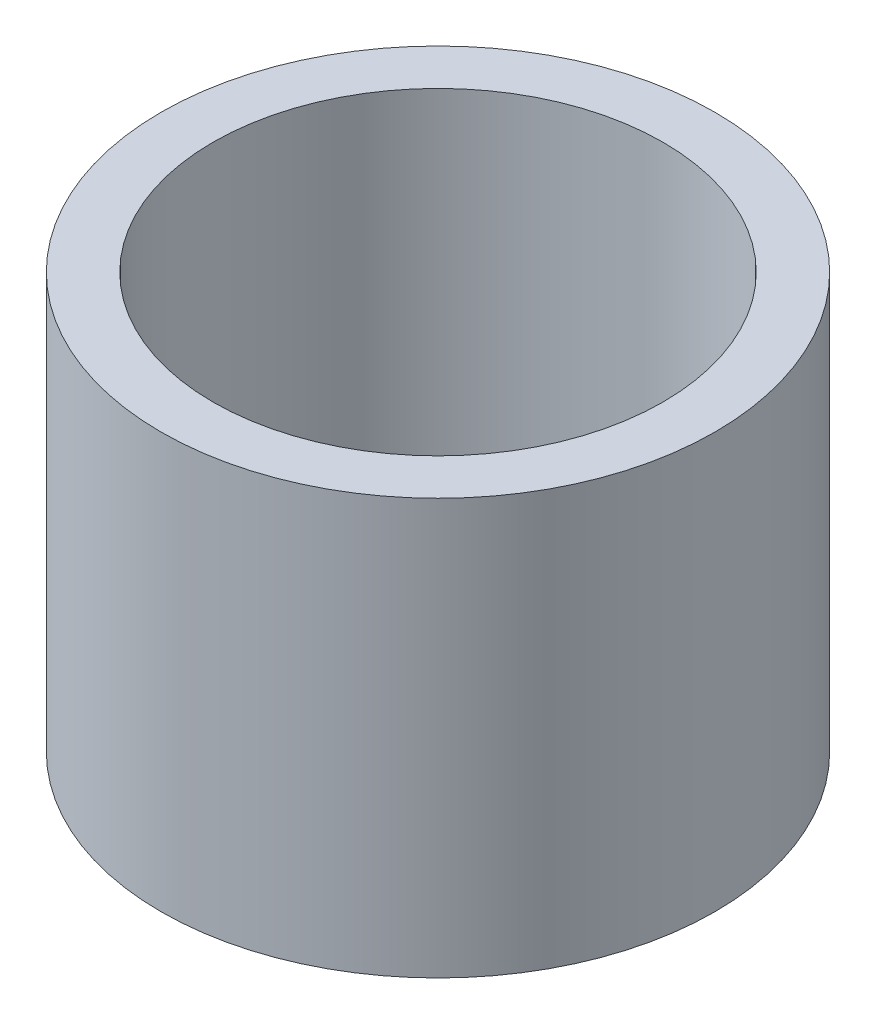
from build123d import *

# Parameters (mm, degrees)
SKETCH1_R           = 12.7
SKETCH1_R_2         = 10.31875
BOSS_EXTRUDE1_DEPTH = 19.05


with BuildPart() as part:
    # Sketch1 → Boss-Extrude1 (new body)
    with BuildSketch(Plane(origin=(0, 0, 0), x_dir=(1, 0, 0), z_dir=(0, 1, 0))):
        with Locations(Location((0, 0, 0), (0, 0, 90))):
            Circle(SKETCH1_R)
        with Locations(Location((0, 0, 0), (0, 0, 90))):
            Circle(SKETCH1_R_2, mode=Mode.SUBTRACT)
    extrude(amount=BOSS_EXTRUDE1_DEPTH)


solid = part.part
